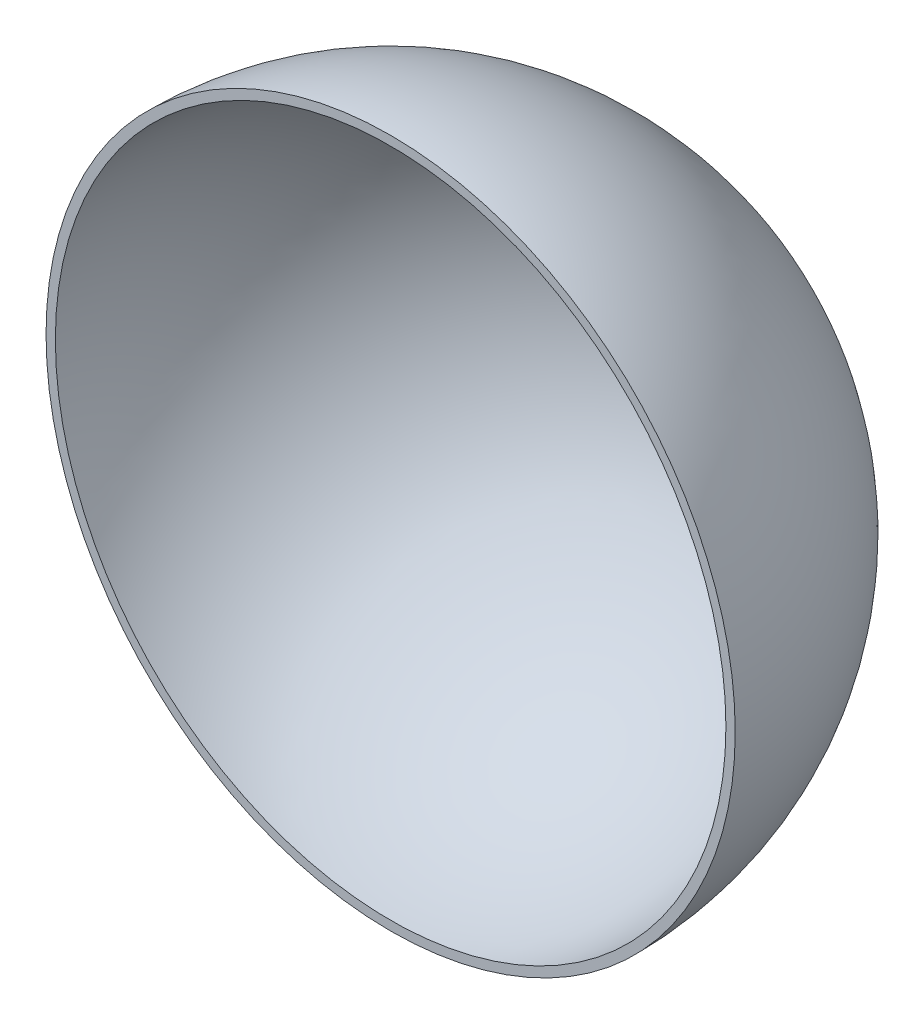
from build123d import *

# Parameters (mm, degrees)
REVOLVE1_ANGLE     = 180
SKETCH2_R          = 6.35
CUT_EXTRUDE1_DEPTH = 407.945337238


with BuildPart() as part:
    # Sketch1 → Revolve1 (revolve)
    with BuildSketch(Plane.XY):
        with BuildLine():
            ThreePointArc((0, 234.95), (234.95, 0), (0, -234.95))
            Line((0, -234.95), (0, -228.6))
            ThreePointArc((0, -228.6), (228.6, 0), (0, 228.6))
            Line((0, 228.6), (0, 234.95))
        make_face()
    revolve(axis=Axis((0, -228.6, 0), (0, 1, 0)), revolution_arc=REVOLVE1_ANGLE)

    # Sketch2 → Cut-Extrude1 (cut, through all)
    with BuildSketch(Plane(origin=(0, 0, -234.95), x_dir=(-1, 0, 0), z_dir=(0, 0, -1))):
        with Locations(Location((0, 0, 0), (0, 0, 180))):
            Circle(SKETCH2_R)
    extrude(amount=-CUT_EXTRUDE1_DEPTH, mode=Mode.SUBTRACT)


solid = part.part
